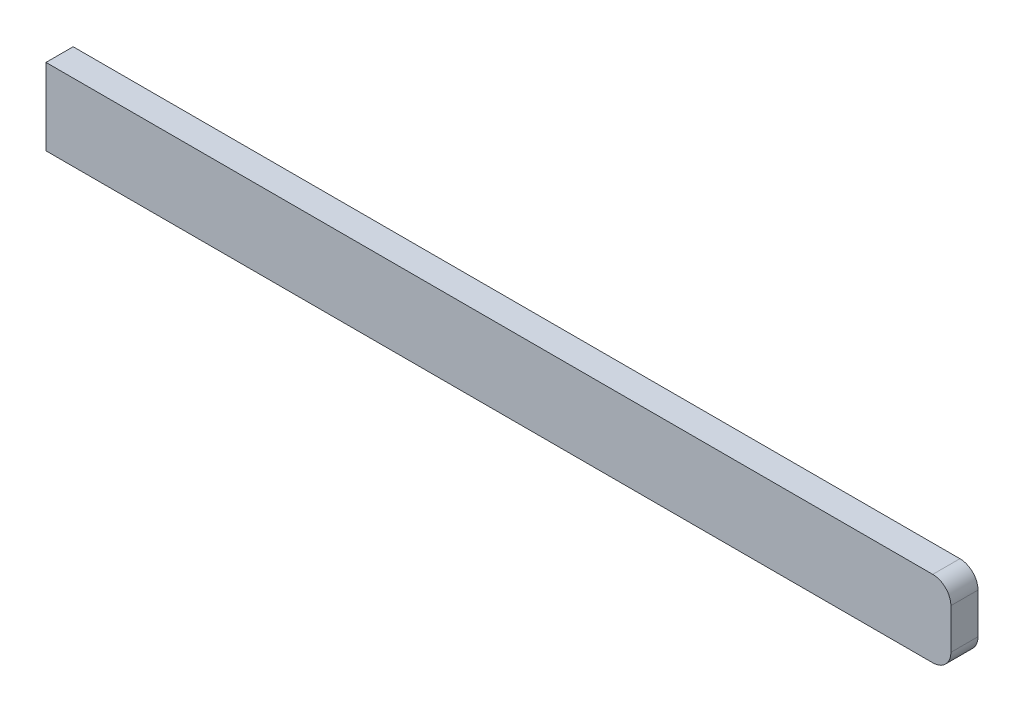
from build123d import *

# Parameters (mm, degrees)
SKETCH1_W           = 150
SKETCH1_H           = 12.7
BOSS_EXTRUDE1_DEPTH = 4.5
FILLET1_R           = 3


with BuildPart() as part:
    # Sketch1 → Boss-Extrude1 (new body)
    with BuildSketch(Plane.XY):
        with Locations((62.3, 71.35)):
            Rectangle(SKETCH1_W, SKETCH1_H)
    extrude(amount=BOSS_EXTRUDE1_DEPTH)

    # Fillet1
    fillet1_edges = [part.edges().sort_by_distance(p)[0] for p in [
        (137.3, 77.7, 2.25),
        (137.3, 65, 2.25),
    ]]
    fillet(fillet1_edges, radius=FILLET1_R)


solid = part.part
